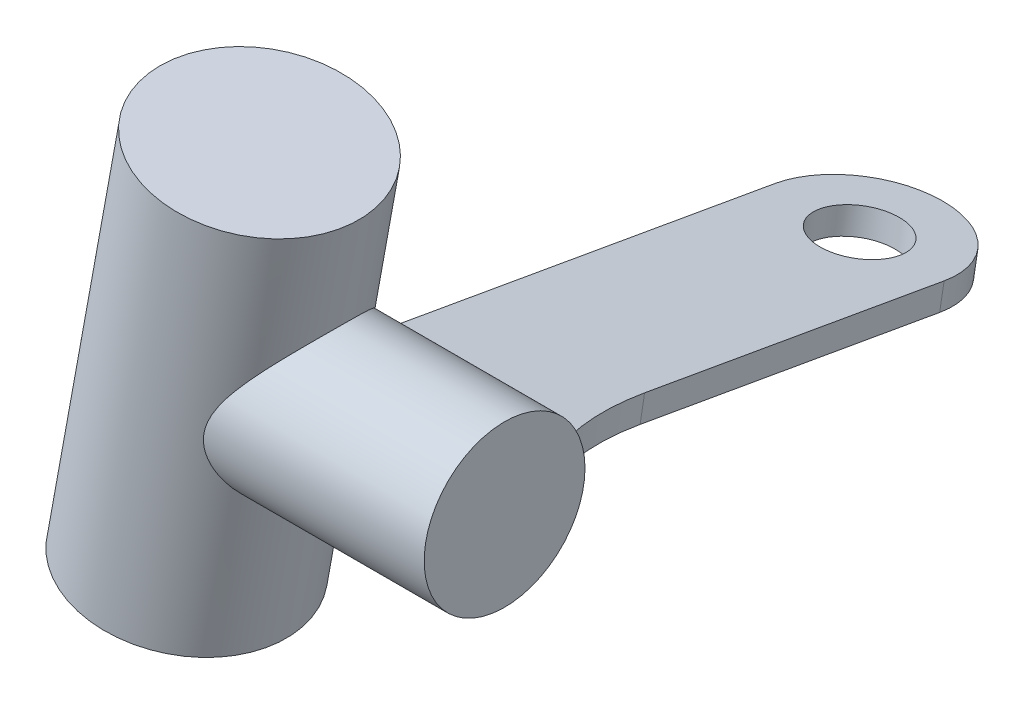
from build123d import *

# Parameters (mm, degrees)
BOSS_EXTRUDE1_DEPTH      = 25
BOSS_EXTRUDE1_DEPTH_BACK = 10
SKETCH1_R                = 10
SKETCH2_R                = 12.5
BOSS_EXTRUDE2_DEPTH      = 25
BOSS_EXTRUDE3_DEPTH      = 15
BOSS_EXTRUDE3_DEPTH_BACK = 15
CUT_EXTRUDE1_DEPTH       = 15
BOSS_EXTRUDE4_DEPTH      = 3.175
CUT_EXTRUDE2_DEPTH       = 96.96083651
CUT_EXTRUDE2_DEPTH_BACK  = 96.96083651
SKETCH10_R               = 5
CUT_EXTRUDE3_DEPTH       = 10


with BuildPart() as part:
    # Sketch1 → Boss-Extrude1 (new, two sides: drawn at the far end of the back side and taken through both)
    with BuildSketch(Plane(origin=(0, 0, 0), x_dir=(0, 0, -1), z_dir=(1, 0, 0)).offset(-BOSS_EXTRUDE1_DEPTH_BACK)):
        Circle(SKETCH1_R)
    extrude(amount=BOSS_EXTRUDE1_DEPTH + BOSS_EXTRUDE1_DEPTH_BACK)

    # Sketch2 → Boss-Extrude2 (add, symmetric)
    with BuildSketch(Plane(origin=(-10, 0, 0), x_dir=(0.9848069802426886, -0.173652560203633, 1.5808464272800858e-08), z_dir=(0.17364817766692736, 0.9847821256419462, -0.007104604780387524))):
        Circle(SKETCH2_R)
    extrude(amount=BOSS_EXTRUDE2_DEPTH, both=True)

    # Sketch5 → Boss-Extrude3 (add, two sides: drawn at the far end of the back side and taken through both)
    with BuildSketch(Plane(origin=(0, 0, 0), x_dir=(0, 0, -1), z_dir=(1, 0, 0)).offset(-BOSS_EXTRUDE3_DEPTH_BACK)):
        Polygon((0.79375, 1.374815329), (-0.79375, -1.374815329), (23.864525326, -15.611277226), (25.452025326, -12.861646569), align=None)
    extrude(amount=BOSS_EXTRUDE3_DEPTH + BOSS_EXTRUDE3_DEPTH_BACK)

    # Sketch6 → Cut-Extrude1 (cut)
    with BuildSketch(Plane(origin=(0, 1.374815329, -0.79375), x_dir=(1, 0, 0), z_dir=(0, 0.8660254037844419, -0.49999999999999434))):
        Polygon((15, 28.472923795), (15, 10), (8.276405599, 28.472923795), align=None)
    extrude(amount=-CUT_EXTRUDE1_DEPTH, mode=Mode.SUBTRACT)

    # Sketch8 → Boss-Extrude4 (add)
    with BuildSketch(Plane(origin=(0, -11.059465432, 1.950082148), x_dir=(1, 0, 0), z_dir=(0, 0.9848077530122095, -0.17364817766692275))):
        with BuildLine():
            Line((-15, 26.212839405), (8.276405599, 26.212839405))
            ThreePointArc((8.276405599, 26.212839405), (6.573986329, 32.197305321), (6, 38.392674831))
            Line((6, 38.392674831), (6, 76.212839405))
            ThreePointArc((6, 76.212839405), (-4.5, 86.712839405), (-15, 76.212839405))
            Line((-15, 76.212839405), (-15, 26.212839405))
        make_face()
    extrude(amount=BOSS_EXTRUDE4_DEPTH)

    # Sketch9 → Cut-Extrude2 (cut, two sides: drawn at the far end of the back side and taken through both)
    with BuildSketch(Plane(origin=(0, -7.932700816, 1.398749184), x_dir=(1, 0, 0), z_dir=(0, 0.9848077530122094, -0.173648177666923)).offset(-CUT_EXTRUDE2_DEPTH_BACK)):
        with BuildLine():
            Line((10.969458516, 56.012713561), (13.826274408, 16.792062616))
            ThreePointArc((13.826274408, 16.792062616), (6.0891037, 35.942860434), (10.969458516, 56.012713561))
        make_face()
    extrude(amount=CUT_EXTRUDE2_DEPTH + CUT_EXTRUDE2_DEPTH_BACK, mode=Mode.SUBTRACT)

    # Sketch10 → Cut-Extrude3 (cut)
    with BuildSketch(Plane(origin=(0, -7.932700816, 1.398749184), x_dir=(1, 0, 0), z_dir=(0, 0.9848077530122094, -0.17364817766692284))):
        with Locations((-4.5, 76.212839405)):
            Circle(SKETCH10_R)
    extrude(amount=-CUT_EXTRUDE3_DEPTH, mode=Mode.SUBTRACT)


solid = part.part
